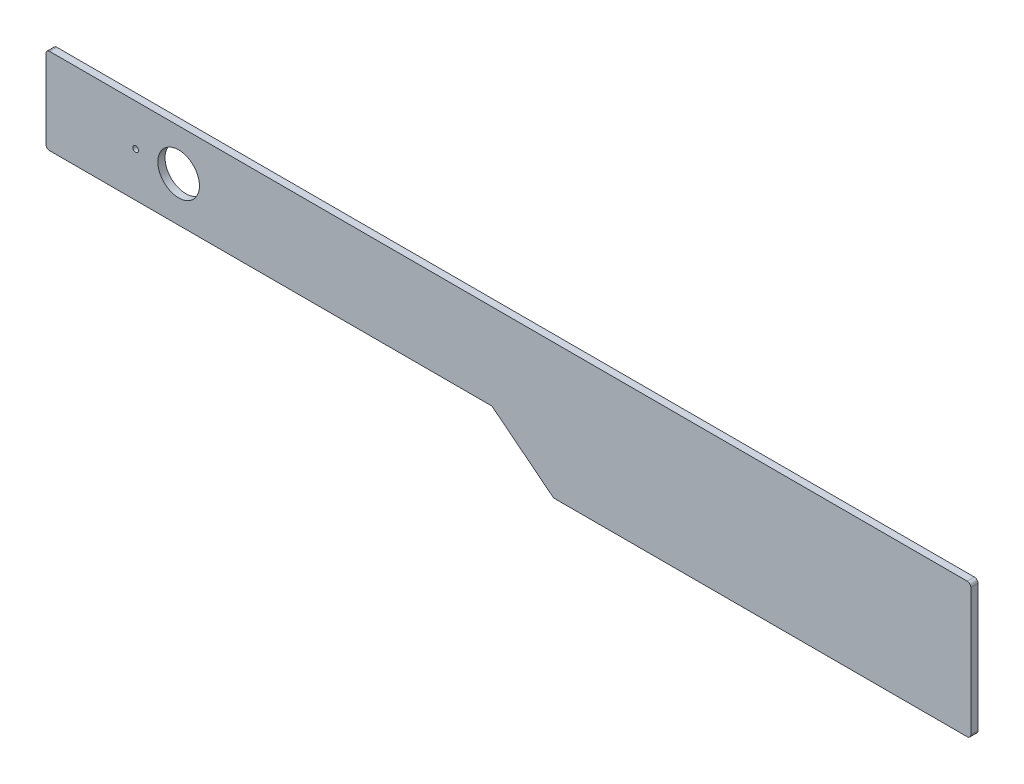
from build123d import *

# Parameters (mm, degrees)
SKETCH_1_R      = 2.9
SKETCH_1_R_2    = 0.4
EXTRUDE_1_DEPTH = 1


with BuildPart() as part:
    # Эскиз1 → Бобышка-Вытянуть1 (new body)
    with BuildSketch(Plane.XY):
        with BuildLine():
            Line((6.163674565, -12.692207796), (-2.163674565, -6.107792204))
            ThreePointArc((-2.163674565, -6.107792204), (-2.309633742, -6.027716241), (-2.473792357, -6))
            Line((-2.473792357, -6), (-64, -6))
            ThreePointArc((-64, -6), (-64.353553391, -5.853553391), (-64.5, -5.5))
            Line((-64.5, -5.5), (-64.5, 5.5))
            ThreePointArc((-64.5, 5.5), (-64.353553391, 5.853553391), (-64, 6))
            Line((-64, 6), (64, 6))
            ThreePointArc((64, 6), (64.353553391, 5.853553391), (64.5, 5.5))
            Line((64.5, 5.5), (64.5, -6))
            Line((64.5, -6), (64.5, -12.3))
            ThreePointArc((64.5, -12.3), (64.353553391, -12.653553391), (64, -12.8))
            Line((64, -12.8), (6.473792357, -12.8))
            ThreePointArc((6.473792357, -12.8), (6.309633742, -12.772283759), (6.163674565, -12.692207796))
        make_face()
        with Locations((-46, 0.2)):
            Circle(SKETCH_1_R, mode=Mode.SUBTRACT)
        with Locations((-52, 0.2)):
            Circle(SKETCH_1_R_2, mode=Mode.SUBTRACT)
    extrude(amount=EXTRUDE_1_DEPTH)


solid = part.part
